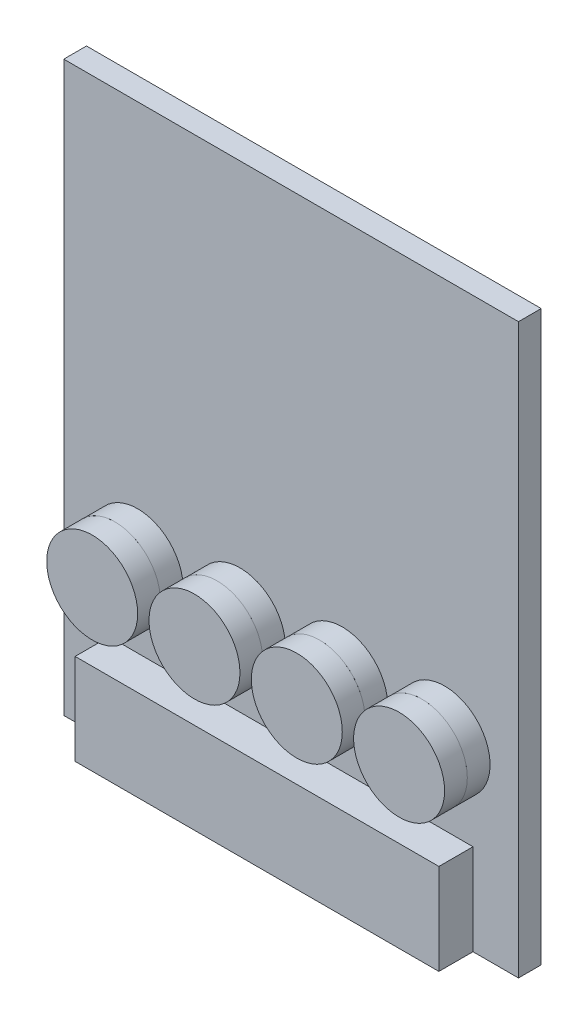
from build123d import *

# Parameters (mm, degrees)
SKETCH_1_W      = 40
SKETCH_1_H      = 50
EXTRUDE_1_DEPTH = 2
SKETCH_2_R      = 4
EXTRUDE_2_DEPTH = 2
SKETCH_3_R      = 4
EXTRUDE_3_DEPTH = 2
SKETCH_4_R      = 4
EXTRUDE_4_DEPTH = 2
SKETCH_5_R      = 4
EXTRUDE_5_DEPTH = 2
SKETCH_7_R      = 4
EXTRUDE_6_DEPTH = 2
SKETCH_8_W      = 32
SKETCH_8_H      = 8
EXTRUDE_7_DEPTH = 3


with BuildPart() as part:
    # 草图1 → 凸台-拉伸1 (new body)
    with BuildSketch(Plane.XY):
        with Locations((20, 25)):
            Rectangle(SKETCH_1_W, SKETCH_1_H)
    extrude(amount=EXTRUDE_1_DEPTH)

    # 草图2 → 凸台-拉伸2 (add)
    with BuildSketch(Plane.XY.offset(2)):
        with Locations(Location((6.5, 15, 0), (0, 0, 180))):
            Circle(SKETCH_2_R)
        with Locations(Location((15.5, 15, 0), (0, 0, 180))):
            Circle(SKETCH_2_R)
        with Locations(Location((24.5, 15, 0), (0, 0, 180))):
            Circle(SKETCH_2_R)
        with Locations(Location((33.5, 15, 0), (0, 0, 180))):
            Circle(SKETCH_2_R)
    extrude(amount=EXTRUDE_2_DEPTH)

    # 草图8 → 凸台-拉伸7 (add)
    with BuildSketch(Plane.XY.offset(2)):
        with Locations((20, 4)):
            Rectangle(SKETCH_8_W, SKETCH_8_H)
    extrude(amount=EXTRUDE_7_DEPTH)


with BuildPart() as body_2:
    # 草图3 → 凸台-拉伸3 (new body)
    with BuildSketch(Plane.XY.offset(4)):
        with Locations((6.5, 15)):
            Circle(SKETCH_3_R)
    extrude(amount=EXTRUDE_3_DEPTH)


with BuildPart() as body_3:
    # 草图4 → 凸台-拉伸4 (new body)
    with BuildSketch(Plane.XY.offset(4)):
        with Locations((15.5, 15)):
            Circle(SKETCH_4_R)
    extrude(amount=EXTRUDE_4_DEPTH)


with BuildPart() as body_4:
    # 草图5 → 凸台-拉伸5 (new body)
    with BuildSketch(Plane.XY.offset(4)):
        with Locations((24.5, 15)):
            Circle(SKETCH_5_R)
    extrude(amount=EXTRUDE_5_DEPTH)


with BuildPart() as body_5:
    # 草图7 → 凸台-拉伸6 (new body)
    with BuildSketch(Plane.XY.offset(4)):
        with Locations((33.5, 15)):
            Circle(SKETCH_7_R)
    extrude(amount=EXTRUDE_6_DEPTH)


solid = Compound([part.part, body_2.part, body_3.part, body_4.part, body_5.part])
